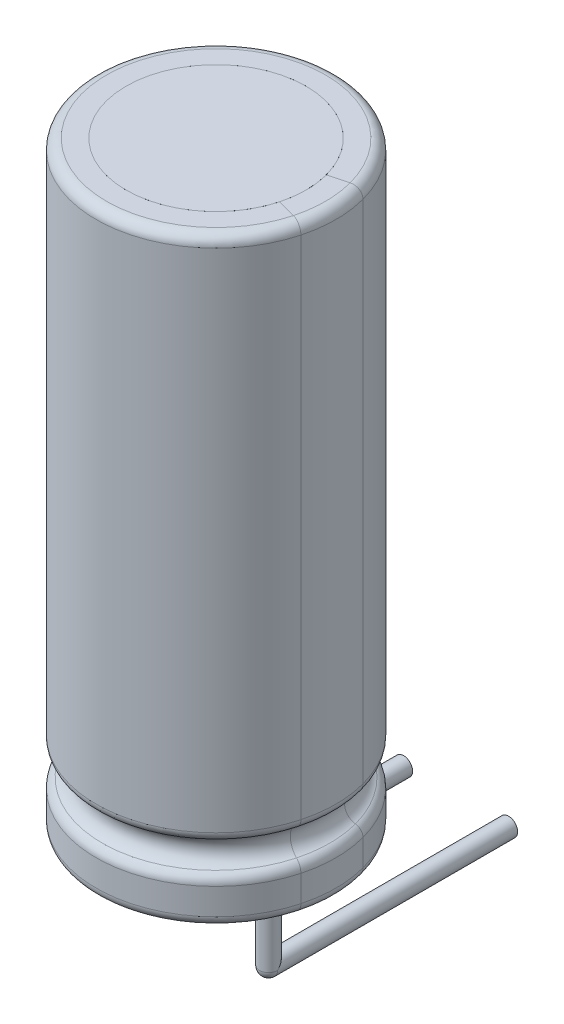
from build123d import *

# Parameters (mm, degrees)
SALIENTE_EXTRUIR3_DEPTH   = 20
SALIENTE_EXTRUIR4_DEPTH   = 20
SALIENTE_EXTRUIR5_DEPTH   = 20
CROQUIS3_R                = 0.4999999999999999
REDONDEO1_R               = 0.35
REDONDEO2_R               = 0.35
CROQUIS4_R                = 0.30107653954551516
SALIENTE_EXTRUIR6_DEPTH   = 3
CROQUIS4_R_2              = 0.30302467240714076
SALIENTE_EXTRUIR6_2_DEPTH = 3
CROQUIS5_R                = 0.30107653954551516
CROQUIS5_R_2              = 0.30302467240714076
SALIENTE_EXTRUIR7_DEPTH   = 8


with BuildPart() as part:
    # Croquis1 → Saliente-Extruir3 (new body)
    with BuildSketch(Plane(origin=(0, 0, 0), x_dir=(1, 0, 0), z_dir=(0, 1, 0))):
        with BuildLine():
            Line((3.8637033051562724, 1.0352761804100858), (2.8977774788672046, 0.7764571353075645))
            ThreePointArc((2.897777478867204, 0.7764571353075644), (2.974334584121431, 0.3915785766601559), (3, 0))
            ThreePointArc((3, -7.3e-16), (2.974334584121431, -0.3915785766601577), (2.897777478867204, -0.7764571353075647))
            Line((2.8977774788672046, -0.7764571353075641), (3.8637033051562724, -1.0352761804100854))
            ThreePointArc((3.8637033051562724, -1.0352761804100863), (3.965779445495241, -0.5221047688802103), (4, -9.8e-16))
            ThreePointArc((4, 0), (3.9657794454952415, 0.5221047688802078), (3.8637033051562724, 1.0352761804100858))
        make_face()
    extrude(amount=SALIENTE_EXTRUIR3_DEPTH)


with BuildPart() as body_2:
    # Croquis1<5> → Saliente-Extruir4 (new body)
    with BuildSketch(Plane(origin=(0, 0, 0), x_dir=(1, 0, 0), z_dir=(0, 1, 0))):
        with BuildLine():
            ThreePointArc((3, 0), (2.974334584121431, 0.3915785766601559), (2.897777478867204, 0.7764571353075644))
            ThreePointArc((2.897777478867204, 0.7764571353075644), (-3, -9.6e-16), (2.897777478867205, -0.776457135307562))
            ThreePointArc((2.897777478867204, -0.7764571353075647), (2.974334584121431, -0.3915785766601577), (3, -7.3e-16))
        make_face()
    extrude(amount=SALIENTE_EXTRUIR4_DEPTH)


with BuildPart() as body_3:
    # Croquis1<6> → Saliente-Extruir5 (new body)
    with BuildSketch(Plane(origin=(0, 0, 0), x_dir=(1, 0, 0), z_dir=(0, 1, 0))):
        with BuildLine():
            ThreePointArc((2.897777478867205, -0.776457135307562), (-3, -9.6e-16), (2.897777478867204, 0.7764571353075644))
            Line((2.8977774788672046, 0.7764571353075645), (3.8637033051562724, 1.0352761804100858))
            ThreePointArc((3.8637033051562724, 1.0352761804100858), (-4, 4.9e-16), (3.8637033051562724, -1.0352761804100863))
            Line((3.8637033051562724, -1.0352761804100854), (2.8977774788672046, -0.7764571353075641))
        make_face()
    extrude(amount=SALIENTE_EXTRUIR5_DEPTH)


with BuildPart() as cortar_revoluci_n1_tool:
    # Croquis3 → Cortar-Revolución1 (revolve)
    with BuildSketch(Plane(origin=(0, 0, 0), x_dir=(0, 0, -1), z_dir=(1, 0, 0))):
        with Locations((-4, 1.9999999999999982)):
            Circle(CROQUIS3_R)
    revolve(axis=Axis((0, -1.7359986127882774, 0), (0, 1, 0)))


with BuildPart() as part_1:
    add(part.part)

    # Cortar-Revolución1: cut by cortar_revoluci_n1_tool
    add(cortar_revoluci_n1_tool.part, mode=Mode.SUBTRACT)

    # Redondeo2
    redondeo2_edges = [part_1.edges().sort_by_distance(p)[0] for p in [
        (4, 0, -4.7e-16),
        (3.999999999997482, 1.4999999999999982, -7.0699e-12),
        (3.999999999997482, 2.4999999999999982, 7.09233e-12),
        (4.000000000000001, 20, 6.7e-16),
    ]]
    fillet(redondeo2_edges, radius=REDONDEO2_R)


with BuildPart() as body_3_1:
    add(body_3.part)

    # Cortar-Revolución1: cut by cortar_revoluci_n1_tool
    add(cortar_revoluci_n1_tool.part, mode=Mode.SUBTRACT)

    # Redondeo1
    redondeo1_edges = [body_3_1.edges().sort_by_distance(p)[0] for p in [
        (-4, 0, 6.55e-15),
        (-3.1734133611649407, 1.4999999999999982, -2.435045716034882),
        (-3.1734133611649407, 2.4999999999999982, -2.435045716034882),
        (-4, 20, 6.55e-15),
    ]]
    fillet(redondeo1_edges, radius=REDONDEO1_R)


with BuildPart() as body_4:
    # Croquis4 → Saliente-Extruir6 (new body)
    with BuildSketch(Plane.XZ):
        with Locations((-1.75, 0)):
            Circle(CROQUIS4_R)
    extrude(amount=SALIENTE_EXTRUIR6_DEPTH)



with BuildPart() as body_5:
    # Croquis4 → Saliente-Extruir6 2 (new body)
    with BuildSketch(Plane.XZ):
        with Locations((1.75, 0)):
            Circle(CROQUIS4_R_2)
    extrude(amount=SALIENTE_EXTRUIR6_2_DEPTH)


with BuildPart() as body_4_1:
    add(body_4.part)

    add(body_5.part)  # Saliente-Extruir7 merges body 5
    # Croquis5 → Saliente-Extruir7 (add)
    with BuildSketch(Plane.XY):
        with Locations((-1.75, -3)):
            Circle(CROQUIS5_R)
        with Locations((1.75, -3)):
            Circle(CROQUIS5_R_2)
    extrude(amount=-SALIENTE_EXTRUIR7_DEPTH)

    # Croquis6 → Revolución1 (revolve)
    with BuildSketch(Plane.XY):
        with BuildLine():
            Line((-1.448923460454485, -3), (-2.051076539545515, -3))
            ThreePointArc((-2.051076539545515, -3), (-1.75, -3.301076539545515), (-1.448923460454485, -3))
        make_face()
        with BuildLine():
            Line((2.053024672407141, -3), (1.4469753275928592, -3))
            ThreePointArc((1.4469753275928592, -3), (1.75, -3.303024672407141), (2.053024672407141, -3))
        make_face()
    revolve(axis=Axis((2.053024672407141, -3, 0), (-1, 0, 0)))


solid = Compound([body_2.part, part_1.part, body_3_1.part, body_4_1.part])
